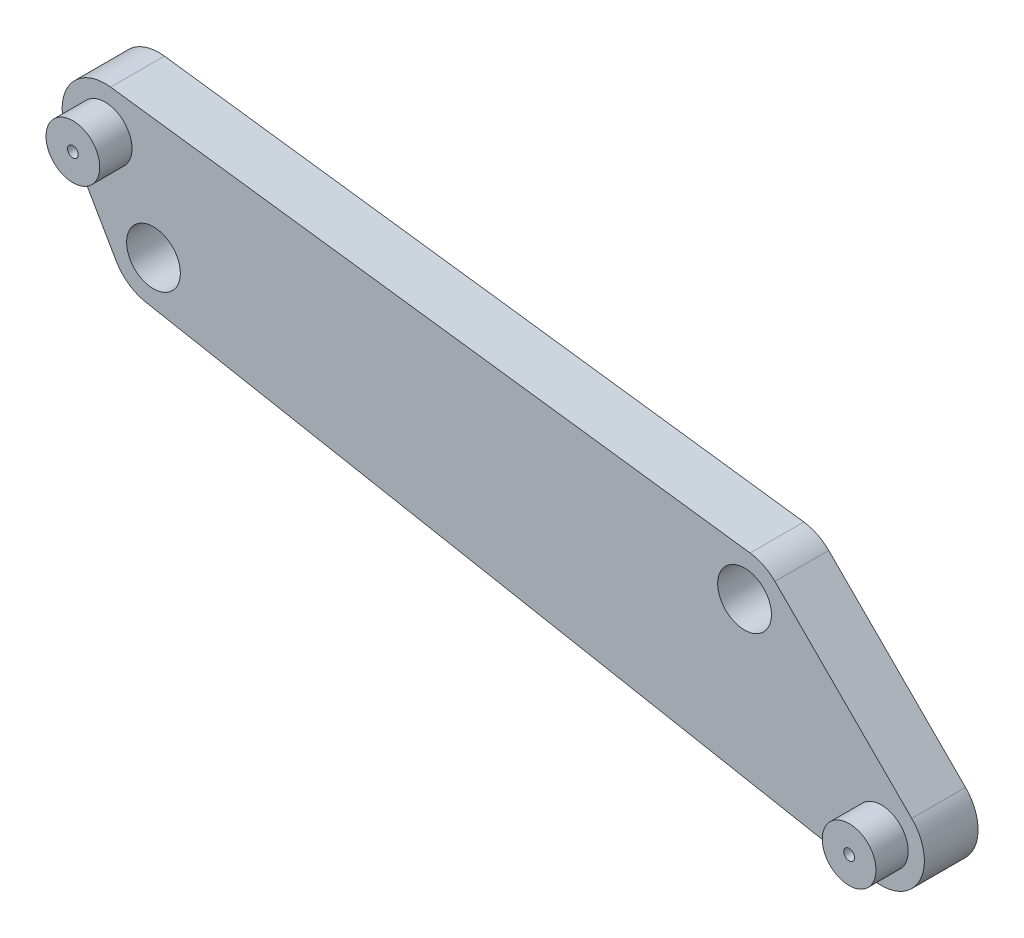
from build123d import *

# Parameters (mm, degrees)
SKETCH2_R           = 2.5
BOSS_EXTRUDE1_DEPTH = 5
SKETCH4_R           = 2.5
SKETCH4_R_2         = 0.5
BOSS_EXTRUDE3_DEPTH = 8


with BuildPart() as part:
    # Sketch2 → Boss-Extrude1 (new body)
    with BuildSketch(Plane.XY):
        with BuildLine():
            Line((-58.980456911, 11.76034449), (0.519543089, 3.966115855))
            ThreePointArc((0.519543089, 3.966115855), (1.767996055, 3.588062144), (2.828427125, 2.828427125))
            Line((2.828427125, 2.828427125), (15.556349186, -9.899494937))
            ThreePointArc((15.556349186, -9.899494937), (16.265540761, -14.594805544), (11.989145433, -16.659106246))
            Line((11.989145433, -16.659106246), (-55.738776628, -3.931184185))
            ThreePointArc((-55.738776628, -3.931184185), (-57.312663934, -3.263676689), (-58.464101615, -2))
            Line((-58.464101615, -2), (-62.964101615, 5.794228634))
            ThreePointArc((-62.964101615, 5.794228634), (-62.826595982, 10.015435327), (-58.980456911, 11.76034449))
        make_face()
        with Locations((-55, 0)):
            Circle(SKETCH2_R, mode=Mode.SUBTRACT)
        with Locations((-59.5, 7.794228634)):
            Circle(SKETCH2_R, mode=Mode.SUBTRACT)
        Circle(SKETCH2_R, mode=Mode.SUBTRACT)
        with Locations((12.727922061, -12.727922061)):
            Circle(SKETCH2_R, mode=Mode.SUBTRACT)
    extrude(amount=BOSS_EXTRUDE1_DEPTH)

    # Sketch4 → Boss-Extrude3 (add)
    # profile 1 of 2: a face of its own
    with BuildSketch(Plane(origin=(0, 0, 0), x_dir=(-1, 0, 0), z_dir=(0, 0, -1))):
        with Locations((59.5, 7.794228634)):
            Circle(SKETCH4_R)
        with Locations((59.5, 7.794228634)):
            Circle(SKETCH4_R_2, mode=Mode.SUBTRACT)
    # profile 2 of 2: a face of its own
    with BuildSketch(Plane(origin=(0, 0, 0), x_dir=(-1, 0, 0), z_dir=(0, 0, -1))):
        with Locations((-12.727922061, -12.727922061)):
            Circle(SKETCH4_R)
        with Locations((-12.727922061, -12.727922061)):
            Circle(SKETCH4_R_2, mode=Mode.SUBTRACT)
    extrude(amount=-BOSS_EXTRUDE3_DEPTH)


solid = part.part
